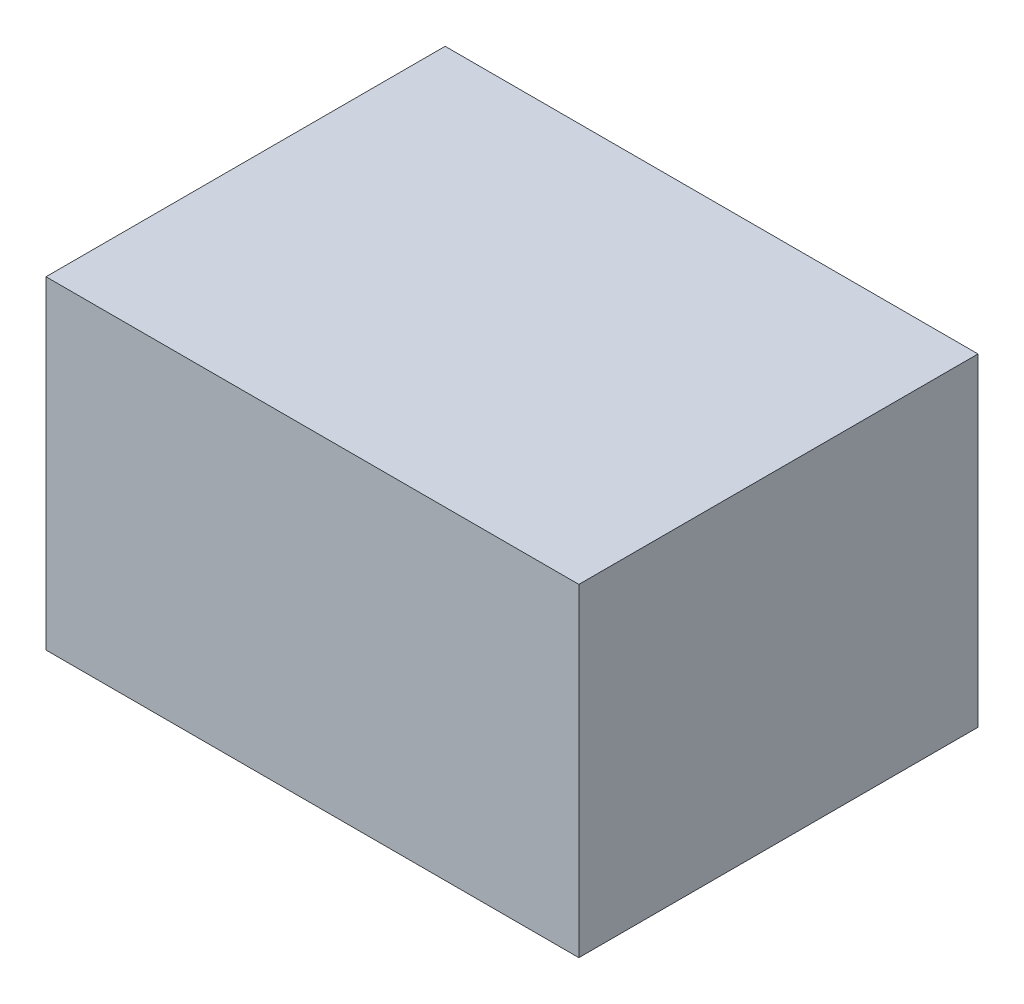
from build123d import *

# Parameters (mm, degrees)
SKETCH1_W           = 22.7
SKETCH1_H           = 12.2
BOSS_EXTRUDE1_DEPTH = 3.5
SKETCH2_W           = 26.7
SKETCH2_H           = 16.2
SKETCH2_W_2         = 22.7
SKETCH2_H_2         = 12.2
BOSS_EXTRUDE2_DEPTH = 20
SKETCH3_W           = 3
SKETCH3_H           = 10.2
CUT_EXTRUDE1_DEPTH  = 2


with BuildPart() as part:
    # Sketch1 → Boss-Extrude1 (new body)
    with BuildSketch(Plane.XY):
        Rectangle(SKETCH1_W, SKETCH1_H)
    extrude(amount=BOSS_EXTRUDE1_DEPTH)

    # Sketch2 → Boss-Extrude2 (add)
    with BuildSketch(Plane.XY.offset(3.5)):
        Rectangle(SKETCH2_W, SKETCH2_H)
        Rectangle(SKETCH2_W_2, SKETCH2_H_2, mode=Mode.SUBTRACT)
    extrude(amount=-BOSS_EXTRUDE2_DEPTH)

    # Sketch3 → Cut-Extrude1 (cut)
    with BuildSketch(Plane.ZY.offset(13.35)):
        with Locations((-1.5, 0)):
            Rectangle(SKETCH3_W, SKETCH3_H)
    extrude(amount=-CUT_EXTRUDE1_DEPTH, mode=Mode.SUBTRACT)


solid = part.part
